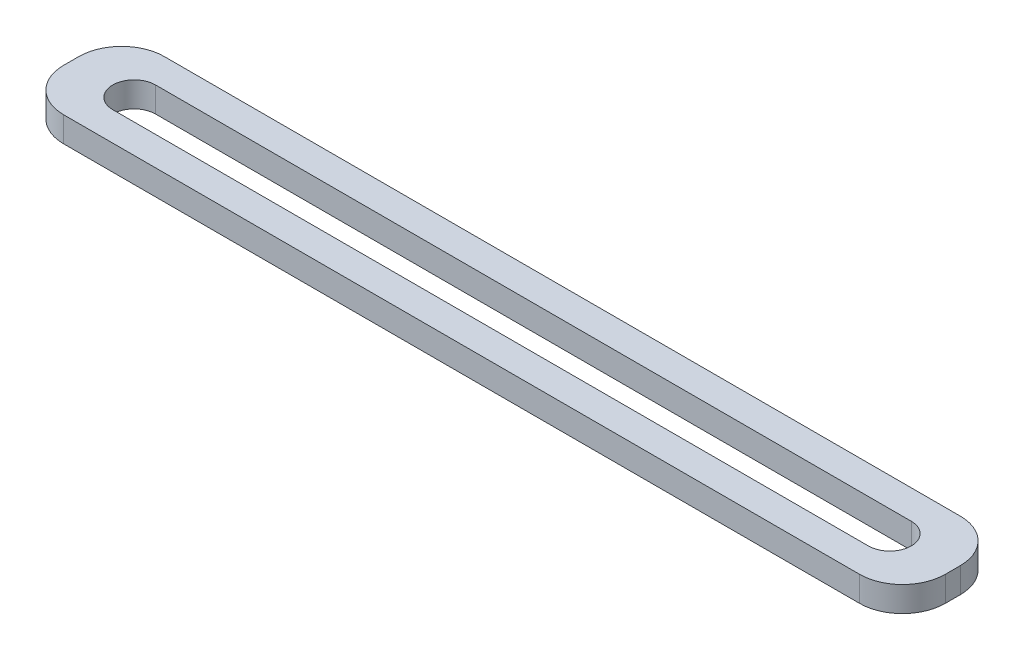
from build123d import *

# Parameters (mm, degrees)
SKETCH_1_W      = 70
SKETCH_1_H      = 8
EXTRUDE_1_DEPTH = 2
FILLET_1_R      = 3.4


with BuildPart() as part:
    # 草图1 → 凸台-拉伸1 (new body)
    with BuildSketch(Plane(origin=(0, 0, 0), x_dir=(1, 0, 0), z_dir=(0, 1, 0))):
        Rectangle(SKETCH_1_W, SKETCH_1_H)
        with BuildLine():
            ThreePointArc((-30, -1.7), (-31.7, 0), (-30, 1.7))
            Line((-30, 1.7), (30, 1.7))
            ThreePointArc((30, 1.7), (31.202081528, 1.202081528), (31.7, 0))
            ThreePointArc((31.7, 0), (31.202081528, -1.202081528), (30, -1.7))
            Line((30, -1.7), (-30, -1.7))
        make_face(mode=Mode.SUBTRACT)
    extrude(amount=EXTRUDE_1_DEPTH)

    # 圆角1
    fillet_1_edges = [part.edges().sort_by_distance(p)[0] for p in [
        (35, 1, 4),
        (-35, 1, 4),
        (-35, 1, -4),
        (35, 1, -4),
    ]]
    fillet(fillet_1_edges, radius=FILLET_1_R)


solid = part.part
